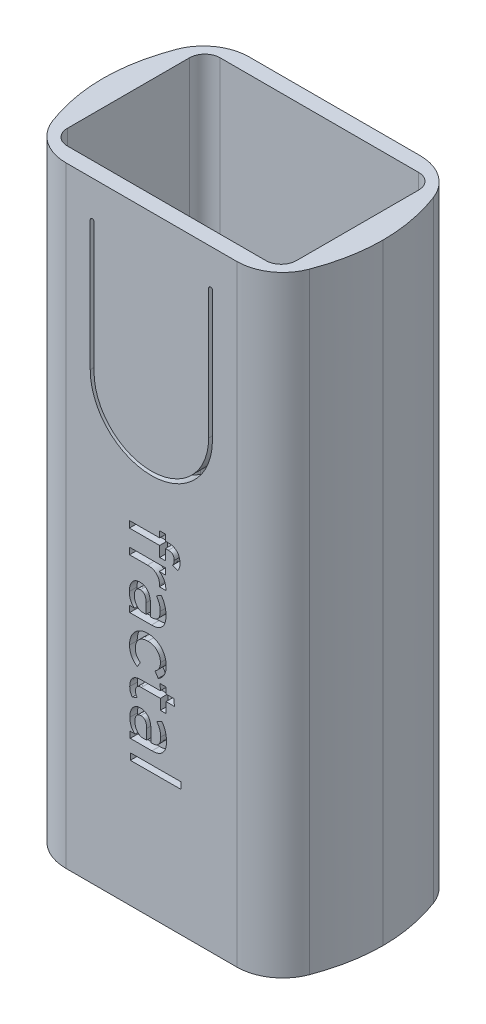
from build123d import *

# Parameters (mm, degrees)
BOSS_EXTRUDE4_DEPTH = 80
BOSS_EXTRUDE5_DEPTH = 57
CUT_EXTRUDE1_DEPTH  = 2
CUT_EXTRUDE2_DEPTH  = 1


with BuildPart() as part:
    # Sketch8 → Boss-Extrude4 (new body)
    with BuildSketch(Plane(origin=(0, 58, 0), x_dir=(1, 0, 0), z_dir=(0, 1, 0))):
        with BuildLine():
            Line((-11.194828593, 12.000000011), (11.194828559, 12.000000011))
            ThreePointArc((11.194828559, 12.000000011), (14.611088941, 10.932460351), (16.811684841, 8.109721678))
            add(Edge.make_bspline(
                [(18.334712564, 1.1e-08), (18.327162677, 2.726130673), (17.819510816, 5.426517656), (16.811684841, 8.109721678)],
                knots=[0.502499344, 0.502499344, 0.502499344, 0.502499344, 0.837905074, 0.837905074, 0.837905074, 0.837905074], degree=3))
            add(Edge.make_bspline(
                [(18.334712564, 1.1e-08), (18.327162677, -2.72613065), (17.819510816, -5.426517634), (16.811684841, -8.109721656)],
                knots=[0.502499344, 0.502499344, 0.502499344, 0.502499344, 0.837905074, 0.837905074, 0.837905074, 0.837905074], degree=3))
            ThreePointArc((16.811684841, -8.109721656), (14.611088941, -10.932460328), (11.194828559, -11.999999989))
            Line((11.194828559, -11.999999989), (-11.194828593, -11.999999989))
            ThreePointArc((-11.194828593, -11.999999989), (-14.611088975, -10.932460328), (-16.811684874, -8.109721656))
            add(Edge.make_bspline(
                [(-18.334712598, 1.1e-08), (-18.327162711, -2.72613065), (-17.81951085, -5.426517634), (-16.811684874, -8.109721656)],
                knots=[0.502499344, 0.502499344, 0.502499344, 0.502499344, 0.837905074, 0.837905074, 0.837905074, 0.837905074], degree=3))
            add(Edge.make_bspline(
                [(-18.334712598, 1.1e-08), (-18.327162711, 2.726130673), (-17.81951085, 5.426517656), (-16.811684874, 8.109721678)],
                knots=[0.502499344, 0.502499344, 0.502499344, 0.502499344, 0.837905074, 0.837905074, 0.837905074, 0.837905074], degree=3))
            ThreePointArc((-16.811684874, 8.109721678), (-14.611088975, 10.932460351), (-11.194828593, 12.000000011))
        make_face()
        with BuildLine():
            Line((-15.000000017, -7.999999989), (-15.000000017, 8.000000011))
            ThreePointArc((-15.000000017, 8.000000011), (-14.414213579, 9.414213574), (-13.000000017, 10.000000011))
            Line((-13.000000017, 10.000000011), (12.999999983, 10.000000011))
            ThreePointArc((12.999999983, 10.000000011), (14.414213546, 9.414213574), (14.999999983, 8.000000011))
            Line((14.999999983, 8.000000011), (14.999999983, -7.999999989))
            ThreePointArc((14.999999983, -7.999999989), (14.414213546, -9.414213551), (12.999999983, -9.999999989))
            Line((12.999999983, -9.999999989), (-13.000000017, -9.999999989))
            ThreePointArc((-13.000000017, -9.999999989), (-14.414213579, -9.414213551), (-15.000000017, -7.999999989))
        make_face(mode=Mode.SUBTRACT)
    extrude(amount=BOSS_EXTRUDE4_DEPTH)

    # Sketch11 → Boss-Extrude5 (add)
    with BuildSketch(Plane(origin=(0, 58, 0), x_dir=(1, 0, 0), z_dir=(0, 1, 0))):
        with BuildLine():
            Line((13, 10.000000011), (15, 10.000000011))
            Line((15, 10.000000011), (15, 6.937911183))
            Line((15, 6.937911183), (13.5, 6.937911183))
            ThreePointArc((13.5, 6.937911183), (13.146446609, 7.084357793), (13, 7.437911183))
            Line((13, 7.437911183), (13, 10.000000011))
        make_face()
        with BuildLine():
            Line((-13, 7.437911183), (-13, 10.000000011))
            Line((-13, 10.000000011), (-15, 10.000000011))
            Line((-15, 10.000000011), (-15, 6.937911183))
            Line((-15, 6.937911183), (-13.5, 6.937911183))
            ThreePointArc((-13.5, 6.937911183), (-13.146446609, 7.084357793), (-13, 7.437911183))
        make_face()
    extrude(amount=BOSS_EXTRUDE5_DEPTH)

    # Sketch12 → Cut-Extrude1 (cut)
    with BuildSketch(Plane.XY.offset(11.999999989)):
        with BuildLine():
            Line((7.5, 133.134156445), (7.5, 116.134156445))
            ThreePointArc((7.5, 116.134156445), (0, 108.634156445), (-7.5, 116.134156445))
            Line((-7.5, 116.134156445), (-7.5, 133.134156445))
            ThreePointArc((-7.5, 133.134156445), (-7.75, 133.384156445), (-8, 133.134156445))
            Line((-8, 133.134156445), (-8, 116.134156445))
            ThreePointArc((-8, 116.134156445), (0, 108.134156445), (8, 116.134156445))
            Line((8, 116.134156445), (8, 133.134156445))
            ThreePointArc((8, 133.134156445), (7.75, 133.384156445), (7.5, 133.134156445))
        make_face()
    extrude(amount=-CUT_EXTRUDE1_DEPTH, mode=Mode.SUBTRACT)

    # Sketch13 → Cut-Extrude2 (cut)
    # profile 1 of 7: a face of its own
    with BuildSketch(Plane.XY.offset(11.999999989)):
        with BuildLine():
            add(Edge.make_bspline(
                [(2.996859787, 100.008970815), (2.994442675, 100.069053526), (2.989871425, 100.182682149), (2.954399054, 100.341902764), (2.892932854, 100.477356256), (2.807324868, 100.589862971), (2.694766888, 100.676080453), (2.558115425, 100.735302508), (2.398722521, 100.769899312), (2.285163968, 100.773613049), (2.225081621, 100.775577939)],
                knots=[0, 0, 0, 0, 1.156076077, 2.186374906, 3.118039986, 3.9991384, 4.880236814, 5.816029218, 6.844489569, 8, 8, 8, 8], degree=3))
            Line((2.225081621, 100.775577939), (1.84500996, 100.774285178))
            Line((1.84500996, 100.774285178), (1.850181003, 99.397494981))
            Line((1.850181003, 99.397494981), (1.096501487, 99.394909459))
            Line((1.096501487, 99.394909459), (1.091330444, 100.753601006))
            Line((1.091330444, 100.753601006), (-2.870981251, 100.739380638))
            Line((-2.870981251, 100.739380638), (-2.873566772, 101.596481014))
            Line((-2.873566772, 101.596481014), (1.088744922, 101.610701382))
            Line((1.088744922, 101.610701382), (1.08486664, 102.414798568))
            Line((1.08486664, 102.414798568), (1.838546157, 102.417384089))
            Line((1.838546157, 102.417384089), (1.842424439, 101.613286904))
            Line((1.842424439, 101.613286904), (2.252229596, 101.614579665))
            add(Edge.make_bspline(
                [(2.252229596, 101.614579665), (2.308321941, 101.613997272), (2.417854173, 101.612860025), (2.577254158, 101.592047583), (2.728348763, 101.562385752), (2.869594544, 101.51628952), (3.002692565, 101.459230051), (3.127645118, 101.389949212), (3.241414284, 101.304630342), (3.346819459, 101.209033008), (3.441022623, 101.101306177), (3.524831441, 100.983775836), (3.592552706, 100.853727478), (3.652318219, 100.715312825), (3.694679474, 100.564613346), (3.727664107, 100.40444935), (3.746966232, 100.233949827), (3.749330197, 100.116748415), (3.750539304, 100.056802963)],
                knots=[0, 0, 0, 0, 1.097709537, 2.143511294, 3.143277349, 4.109492138, 5.047045896, 5.976664486, 6.900016993, 7.825988726, 8.758896387, 9.697854663, 10.64560979, 11.625295719, 12.645514775, 13.704851478, 14.826091653, 16, 16, 16, 16], degree=3))
            add(Edge.make_bspline(
                [(3.750539304, 100.056802963), (3.750047569, 100.009789115), (3.749079732, 99.917256092), (3.733842969, 99.780815792), (3.711288681, 99.648371801), (3.677403212, 99.521551313), (3.636506398, 99.400575985), (3.586122565, 99.287923461), (3.526915558, 99.183812255), (3.480132645, 99.120842998), (3.457082614, 99.089817923)],
                knots=[0, 0, 0, 0, 1.095684027, 2.156533885, 3.197301538, 4.225821855, 5.214090456, 6.172114358, 7.099397213, 8, 8, 8, 8], degree=3))
            Line((3.457082614, 99.089817923), (2.77709046, 99.347077312))
            add(Edge.make_bspline(
                [(2.77709046, 99.347077312), (2.811307768, 99.396864956), (2.878752246, 99.494999551), (2.946247382, 99.659569817), (2.990477945, 99.831238294), (2.994714364, 99.949221384), (2.996859787, 100.008970815)],
                knots=[0, 0, 0, 0, 1.019073746, 2.008658809, 2.991537665, 4, 4, 4, 4], degree=3))
        make_face()
    # profile 2 of 7: a face of its own
    with BuildSketch(Plane.XY.offset(11.999999989)):
        with BuildLine():
            add(Edge.make_bspline(
                [(1.036053582, 97.769942784), (1.103875415, 97.730706339), (1.238462592, 97.652844652), (1.414331417, 97.498394304), (1.564896856, 97.31789749), (1.687801844, 97.110071254), (1.784447341, 96.877975256), (1.856267448, 96.622571505), (1.896540948, 96.342707541), (1.902827244, 96.148515681), (1.906081566, 96.047985467)],
                knots=[0, 0, 0, 0, 0.923300537, 1.832218434, 2.746177591, 3.688542436, 4.671287428, 5.70702361, 6.812960502, 8, 8, 8, 8], degree=3))
            Line((1.906081566, 96.047985467), (1.051566711, 96.045399945))
            add(Edge.make_bspline(
                [(1.051566711, 96.045399945), (1.059606728, 96.073669983), (1.077845414, 96.13780024), (1.078402934, 96.204565772), (1.078714687, 96.241899579)],
                knots=[0, 0, 0, 0, 0.881644283, 2, 2, 2, 2], degree=3))
            add(Edge.make_bspline(
                [(1.078714687, 96.241899579), (1.077689807, 96.298426551), (1.075687482, 96.408864301), (1.053770407, 96.569606212), (1.022117097, 96.721636455), (0.977375298, 96.864667662), (0.917281524, 96.996866022), (0.845372395, 97.119893567), (0.761587599, 97.234133223), (0.663784031, 97.337570309), (0.55537511, 97.431476358), (0.433957469, 97.511338651), (0.303008671, 97.580413374), (0.160791259, 97.636155381), (0.007419093, 97.678798281), (-0.157152279, 97.707547532), (-0.332104665, 97.726484554), (-0.452292275, 97.727865703), (-0.513966555, 97.72857444)],
                knots=[0, 0, 0, 0, 1.095269644, 2.139847753, 3.139419918, 4.103842245, 5.038679069, 5.9485804, 6.862614884, 7.778785143, 8.703109413, 9.636937683, 10.589892468, 11.568861415, 12.592548889, 13.670862473, 14.804802925, 16, 16, 16, 16], degree=3))
            Line((-0.513966555, 97.72857444), (-2.856449032, 97.720817875))
            Line((-2.856449032, 97.720817875), (-2.860327314, 98.577918252))
            Line((-2.860327314, 98.577918252), (1.855663897, 98.594724142))
            Line((1.855663897, 98.594724142), (1.858249418, 97.772528305))
            Line((1.858249418, 97.772528305), (1.036053582, 97.769942784))
        make_face()
    # profile 3 of 7: a face of its own
    with BuildSketch(Plane.XY.offset(11.999999989)):
        with BuildLine():
            add(Edge.make_bspline(
                [(1.920322824, 93.229805924), (1.919366439, 93.150459059), (1.917501675, 92.995748208), (1.894856775, 92.771124833), (1.859541508, 92.560375242), (1.807695396, 92.363868192), (1.740796797, 92.181529158), (1.659143208, 92.013042295), (1.561681632, 91.859387756), (1.448853254, 91.720564081), (1.32118622, 91.596439595), (1.178281321, 91.488817692), (1.020649525, 91.397785483), (0.848158857, 91.32406852), (0.661113429, 91.265706478), (0.458793661, 91.225047002), (0.242062284, 91.200431317), (0.09285678, 91.196845508), (0.016086241, 91.195000505)],
                knots=[0, 0, 0, 0, 1.194633167, 2.329300778, 3.396298306, 4.410116943, 5.385480457, 6.317221988, 7.224663686, 8.119696338, 9.005528062, 9.89987805, 10.807134053, 11.740298557, 12.719455093, 13.753004121, 14.843855749, 16, 16, 16, 16], degree=3))
            Line((0.016086241, 91.195000505), (-2.829280166, 91.184658419))
            Line((-2.829280166, 91.184658419), (-2.833158449, 91.99780493))
            Line((-2.833158449, 91.99780493), (-2.194534639, 92.000390452))
            add(Edge.make_bspline(
                [(-2.194534639, 92.000390452), (-2.247616777, 92.037961494), (-2.354542073, 92.113642221), (-2.490823928, 92.258154022), (-2.6092197, 92.423807132), (-2.706700413, 92.612009284), (-2.784703993, 92.820668672), (-2.837025139, 93.049003021), (-2.873956185, 93.294549747), (-2.877741544, 93.464938443), (-2.879697836, 93.552996111)],
                knots=[0, 0, 0, 0, 0.880187349, 1.772993617, 2.677959877, 3.634756253, 4.6389316, 5.690754913, 6.806571438, 8, 8, 8, 8], degree=3))
            add(Edge.make_bspline(
                [(-2.879697836, 93.552996111), (-2.879022549, 93.617688986), (-2.87770512, 93.743899509), (-2.858208051, 93.928161995), (-2.831060296, 94.103031535), (-2.789846088, 94.268040312), (-2.734578731, 94.422263836), (-2.670864451, 94.568156009), (-2.592613755, 94.702942006), (-2.503491585, 94.827286226), (-2.404686448, 94.939004579), (-2.2977613, 95.037709903), (-2.182215248, 95.120140517), (-2.060079307, 95.189782199), (-1.929698486, 95.243156992), (-1.791911854, 95.279945439), (-1.646846068, 95.304552671), (-1.54739765, 95.307205826), (-1.496443835, 95.308565207)],
                knots=[0, 0, 0, 0, 1.236884418, 2.413060612, 3.540540454, 4.620117252, 5.660332507, 6.671365111, 7.661070386, 8.635589767, 9.593264899, 10.509273167, 11.412884209, 12.302399144, 13.193287967, 14.099152032, 15.026073445, 16, 16, 16, 16], degree=3))
            add(Edge.make_bspline(
                [(-1.496443835, 95.308565207), (-1.445532306, 95.307437441), (-1.345851134, 95.305229355), (-1.199976629, 95.284566442), (-1.06248363, 95.247722858), (-0.932042113, 95.198851825), (-0.809708929, 95.134938196), (-0.694672385, 95.056487193), (-0.587853246, 94.96333538), (-0.488545291, 94.856280929), (-0.398173736, 94.733955208), (-0.321434834, 94.5934665), (-0.25534786, 94.437116795), (-0.200738794, 94.264088316), (-0.161066596, 94.073763353), (-0.129255225, 93.86717281), (-0.111886925, 93.643785235), (-0.109335446, 93.489246963), (-0.108018791, 93.409499668)],
                knots=[0, 0, 0, 0, 0.916463544, 1.794370807, 2.645108922, 3.475213065, 4.297775453, 5.124244829, 5.976856468, 6.844414757, 7.749241036, 8.707930238, 9.719698123, 10.801971438, 11.969358077, 13.217122862, 14.563935505, 16, 16, 16, 16], degree=3))
            Line((-0.108018791, 93.409499668), (-0.102847748, 92.052100882))
            Line((-0.102847748, 92.052100882), (0.061332868, 92.053393642))
            add(Edge.make_bspline(
                [(0.061332868, 92.053393642), (0.104898567, 92.054350398), (0.189735172, 92.056213513), (0.312758117, 92.071655636), (0.427619048, 92.098139993), (0.535195336, 92.132027361), (0.634628708, 92.178322534), (0.726820454, 92.233329617), (0.809878916, 92.300281308), (0.885597231, 92.375840717), (0.953544485, 92.461114878), (1.009325852, 92.557894934), (1.059968557, 92.662305503), (1.098842573, 92.777160081), (1.130339059, 92.901163795), (1.151700016, 93.034413902), (1.164882662, 93.176963701), (1.166045209, 93.275021935), (1.166643308, 93.325470219)],
                knots=[0, 0, 0, 0, 1.087095932, 2.116929776, 3.087495738, 4.026195392, 4.926078734, 5.818799804, 6.698928788, 7.581092451, 8.484759662, 9.410680545, 10.363202438, 11.376790667, 12.430605746, 13.553346728, 14.741263706, 16, 16, 16, 16], degree=3))
            add(Edge.make_bspline(
                [(1.166643308, 93.325470219), (1.164961923, 93.39537432), (1.161617513, 93.534419309), (1.132810638, 93.74144507), (1.089156791, 93.945948508), (1.028798622, 94.146070157), (0.953964715, 94.337117676), (0.869812223, 94.516418755), (0.771385845, 94.679082754), (0.695705137, 94.777033687), (0.658588333, 94.825072687)],
                knots=[0, 0, 0, 0, 1.040240382, 2.069123414, 3.105935914, 4.151149396, 5.176887612, 6.15823228, 7.096724489, 8, 8, 8, 8], degree=3))
            Line((0.658588333, 94.825072687), (1.294626622, 95.184460175))
            add(Edge.make_bspline(
                [(1.294626622, 95.184460175), (1.343463557, 95.121683814), (1.44217203, 94.994801184), (1.565541296, 94.783181412), (1.671764571, 94.554450527), (1.760050802, 94.309401228), (1.831026102, 94.052314931), (1.881219363, 93.785068581), (1.912921225, 93.510228823), (1.917841073, 93.323831522), (1.920322824, 93.229805924)],
                knots=[0, 0, 0, 0, 0.911948218, 1.84321592, 2.803447203, 3.803124136, 4.828931034, 5.860930113, 6.920975116, 8, 8, 8, 8], degree=3))
        make_face()
        with BuildLine():
            add(Edge.make_bspline(
                [(-2.217804332, 93.412085189), (-2.214537109, 93.333058331), (-2.208170566, 93.179065832), (-2.167083783, 92.956340098), (-2.096272486, 92.750594431), (-1.999796995, 92.56285984), (-1.877355526, 92.395038398), (-1.7300613, 92.252551296), (-1.560595648, 92.132296171), (-1.433409886, 92.076642832), (-1.36846052, 92.048222599)],
                knots=[0, 0, 0, 0, 1.107624716, 2.158328203, 3.161069341, 4.1470274, 5.106168223, 6.058611225, 7.008599968, 8, 8, 8, 8], degree=3))
            Line((-1.36846052, 92.048222599), (-0.682004563, 92.050808121))
            Line((-0.682004563, 92.050808121), (-0.685882845, 93.373302367))
            add(Edge.make_bspline(
                [(-0.685882845, 93.373302367), (-0.686779846, 93.417271757), (-0.688522957, 93.502716035), (-0.697534304, 93.626118841), (-0.711581331, 93.741425238), (-0.731488125, 93.847919839), (-0.759295231, 93.945749048), (-0.791083056, 94.035662545), (-0.829854193, 94.116978624), (-0.873737684, 94.18997868), (-0.923468111, 94.254353714), (-0.979097409, 94.310476622), (-1.041564835, 94.357213108), (-1.109682185, 94.39471952), (-1.182706516, 94.425290786), (-1.262477748, 94.445219502), (-1.347740529, 94.458805736), (-1.406755351, 94.459935569), (-1.43697684, 94.460514156)],
                knots=[0, 0, 0, 0, 1.406466117, 2.733139608, 3.955475891, 5.120520237, 6.19399674, 7.205516833, 8.16726469, 9.070230271, 9.924882662, 10.763038536, 11.590013935, 12.410647846, 13.245055596, 14.114254431, 15.03430973, 16, 16, 16, 16], degree=3))
            add(Edge.make_bspline(
                [(-1.43697684, 94.460514156), (-1.466758033, 94.459390642), (-1.524450664, 94.45721415), (-1.609049596, 94.443991346), (-1.68836703, 94.422234587), (-1.763910069, 94.392334027), (-1.833223683, 94.352244736), (-1.897714909, 94.302959217), (-1.958238542, 94.246865116), (-2.032073521, 94.158343832), (-2.108487035, 94.027319074), (-2.172820486, 93.845430846), (-2.211454608, 93.637347272), (-2.215612909, 93.489827848), (-2.217804332, 93.412085189)],
                knots=[0, 0, 0, 0, 0.728138518, 1.410562256, 2.08784356, 2.735384695, 3.39135516, 4.03821034, 4.716474161, 5.404405324, 6.849819608, 8.396140257, 10.100767796, 12, 12, 12, 12], degree=3))
        make_face(mode=Mode.SUBTRACT)
    # profile 4 of 7: a face of its own
    with BuildSketch(Plane.XY.offset(11.999999989)):
        with BuildLine():
            add(Edge.make_bspline(
                [(-2.852254572, 87.496469453), (-2.851758989, 87.555971128), (-2.850780684, 87.673430443), (-2.835485534, 87.84728828), (-2.813279509, 88.016292103), (-2.778772463, 88.180123405), (-2.736564173, 88.339689535), (-2.683573894, 88.49421967), (-2.621126147, 88.644143644), (-2.549075541, 88.788474247), (-2.467480483, 88.926140119), (-2.379745748, 89.057516435), (-2.283349885, 89.180648965), (-2.180562064, 89.296766459), (-2.069992642, 89.404834082), (-1.951586547, 89.504420435), (-1.826906513, 89.597632164), (-1.694230074, 89.681480336), (-1.556564503, 89.758034582), (-1.412950508, 89.823830915), (-1.264622574, 89.879377895), (-1.112536993, 89.926590008), (-0.954920195, 89.960807421), (-0.793585255, 89.986911719), (-0.627301241, 90.002832342), (-0.514977574, 90.004747586), (-0.458061665, 90.005718066)],
                knots=[0, 0, 0, 0, 1.102559599, 2.176508381, 3.232725517, 4.260376471, 5.277606188, 6.290530317, 7.28591771, 8.286132841, 9.277956381, 10.250519377, 11.212395994, 12.174239445, 13.123194071, 14.075370507, 15.04029356, 16.006406081, 16.982407154, 17.958146703, 18.931365508, 19.916799904, 20.907078346, 21.918237249, 22.945142898, 24, 24, 24, 24], degree=3))
            add(Edge.make_bspline(
                [(-0.458061665, 90.005718066), (-0.401139874, 90.005307711), (-0.288364227, 90.004494699), (-0.121784571, 89.987875208), (0.040464776, 89.963352471), (0.198522318, 89.930549532), (0.351330629, 89.884892178), (0.499122517, 89.828738608), (0.643225436, 89.764210259), (0.782395752, 89.689546746), (0.914830813, 89.605336097), (1.041505564, 89.515079497), (1.158989018, 89.414629301), (1.270048168, 89.30806152), (1.373292976, 89.193079829), (1.468039953, 89.070073983), (1.558731612, 88.941063778), (1.637298501, 88.802413072), (1.710988367, 88.659195535), (1.77209148, 88.509066028), (1.825246536, 88.35502173), (1.869991365, 88.196393214), (1.902827187, 88.032461649), (1.927407269, 87.863749555), (1.943660668, 87.690268113), (1.945527734, 87.572778891), (1.946473327, 87.513275342)],
                knots=[0, 0, 0, 0, 1.055574105, 2.091344122, 3.102161191, 4.09941903, 5.083418003, 6.057493825, 7.030781931, 8.010843265, 8.984558129, 9.940887082, 10.893902006, 11.849428613, 12.79486845, 13.757592096, 14.728908118, 15.71757277, 16.711524436, 17.715170923, 18.721425033, 19.73394791, 20.770334824, 21.820688691, 22.896266789, 24, 24, 24, 24], degree=3))
            add(Edge.make_bspline(
                [(1.946473327, 87.513275342), (1.945732196, 87.460252008), (1.944272203, 87.355798466), (1.932581974, 87.201228566), (1.912097884, 87.050927177), (1.881857603, 86.904776461), (1.84514165, 86.762366502), (1.797734559, 86.625020481), (1.74412901, 86.49150538), (1.680253737, 86.36359753), (1.609446897, 86.240694524), (1.530711583, 86.124212384), (1.443876284, 86.015244367), (1.348906162, 85.913966587), (1.246499296, 85.81991858), (1.13780285, 85.730888532), (1.019867867, 85.651203801), (0.937119215, 85.603381652), (0.895458839, 85.579305262)],
                knots=[0, 0, 0, 0, 1.098315491, 2.163631245, 3.208936806, 4.238341213, 5.253833846, 6.253150331, 7.246107156, 8.23217857, 9.212089004, 10.182643593, 11.141800873, 12.095459117, 13.055654333, 14.020403207, 15.003358424, 16, 16, 16, 16], degree=3))
            Line((0.895458839, 85.579305262), (0.486946442, 86.229563919))
            add(Edge.make_bspline(
                [(0.486946442, 86.229563919), (0.543710376, 86.267692451), (0.654723641, 86.342260448), (0.798272701, 86.477620184), (0.922092608, 86.623314349), (1.022180772, 86.783172177), (1.097970037, 86.955250293), (1.154291233, 87.13544852), (1.187322006, 87.325041178), (1.190949393, 87.454111008), (1.192793811, 87.519739146)],
                knots=[0, 0, 0, 0, 1.064608294, 2.082055211, 3.064512282, 4.039542989, 5.011025124, 5.988645313, 6.977286462, 8, 8, 8, 8], degree=3))
            add(Edge.make_bspline(
                [(1.192793811, 87.519739146), (1.190401303, 87.595317604), (1.185706323, 87.743630318), (1.146086945, 87.959721397), (1.080617852, 88.163617562), (0.991668222, 88.355058796), (0.879565561, 88.531500753), (0.743711765, 88.688404271), (0.585606295, 88.823646666), (0.407786873, 88.937747061), (0.212435712, 89.028122873), (0.002046801, 89.092820496), (-0.222102031, 89.132956448), (-0.37644473, 89.136474288), (-0.455476144, 89.138275603)],
                knots=[0, 0, 0, 0, 1.048280959, 2.057112559, 3.036806998, 4.013375124, 4.978893661, 5.928557386, 6.882748488, 7.856529243, 8.851887619, 9.860098612, 10.904260237, 12, 12, 12, 12], degree=3))
            add(Edge.make_bspline(
                [(-0.455476144, 89.138275603), (-0.535333481, 89.135302222), (-0.691273697, 89.129495996), (-0.918222207, 89.09124749), (-1.129004477, 89.022959681), (-1.324052175, 88.931339481), (-1.500531967, 88.815797444), (-1.657391656, 88.679296117), (-1.791484459, 88.52121479), (-1.902672658, 88.344680444), (-1.990579625, 88.152854236), (-2.054232962, 87.948363246), (-2.092799675, 87.73192087), (-2.096625011, 87.583675452), (-2.098575055, 87.508104299)],
                knots=[0, 0, 0, 0, 1.105946299, 2.15962003, 3.174945402, 4.165288797, 5.135212795, 6.086751454, 7.035009744, 7.99524745, 8.967207045, 9.948682835, 10.954298865, 12, 12, 12, 12], degree=3))
            add(Edge.make_bspline(
                [(-2.098575055, 87.508104299), (-2.096094622, 87.442490845), (-2.091219987, 87.313544943), (-2.059944722, 87.124104128), (-2.006548937, 86.944274754), (-1.934216612, 86.7736982), (-1.840882546, 86.614215451), (-1.724145028, 86.469994694), (-1.590902548, 86.33493121), (-1.487026018, 86.260848664), (-1.43409603, 86.223100115)],
                knots=[0, 0, 0, 0, 1.043897527, 2.051504692, 3.045043066, 4.021763435, 4.992958272, 5.973712509, 6.967511037, 8, 8, 8, 8], degree=3))
            Line((-1.43409603, 86.223100115), (-1.83097358, 85.570255937))
            add(Edge.make_bspline(
                [(-1.83097358, 85.570255937), (-1.870932973, 85.593883349), (-1.950314204, 85.640820322), (-2.063139212, 85.719718438), (-2.168246167, 85.806995429), (-2.266456598, 85.901083552), (-2.357027673, 86.002670215), (-2.441837443, 86.109923046), (-2.517958042, 86.225845682), (-2.611198215, 86.389470821), (-2.70717869, 86.609103115), (-2.790083067, 86.889562938), (-2.841584267, 87.187352634), (-2.848647672, 87.391978211), (-2.852254572, 87.496469453)],
                knots=[0, 0, 0, 0, 0.729984724, 1.450149289, 2.162618196, 2.876858015, 3.587196001, 4.301725188, 5.025453056, 5.766089582, 7.262189851, 8.78259527, 10.357044991, 12, 12, 12, 12], degree=3))
        make_face()
    # profile 5 of 7: a face of its own
    with BuildSketch(Plane.XY.offset(11.999999989)):
        with BuildLine():
            add(Edge.make_bspline(
                [(-2.488548033, 81.769594134), (-2.515240623, 81.801733628), (-2.569780857, 81.867403369), (-2.636836669, 81.979003475), (-2.69611242, 82.100866872), (-2.743927204, 82.232813958), (-2.782818456, 82.371493901), (-2.809250964, 82.513892752), (-2.827294005, 82.658119484), (-2.828985957, 82.755053082), (-2.82983687, 82.803802733)],
                knots=[0, 0, 0, 0, 0.900892627, 1.840769012, 2.802000153, 3.823437685, 4.866302937, 5.908213203, 6.948002762, 8, 8, 8, 8], degree=3))
            add(Edge.make_bspline(
                [(-2.82983687, 82.803802733), (-2.828938968, 82.861578418), (-2.827186002, 82.974373276), (-2.810806432, 83.138861116), (-2.780385954, 83.292914482), (-2.74151916, 83.43772261), (-2.687230981, 83.571230884), (-2.62473718, 83.69663747), (-2.547647443, 83.810756856), (-2.459313662, 83.914949001), (-2.359934428, 84.007706752), (-2.250299215, 84.089360611), (-2.129223573, 84.155901524), (-1.998979288, 84.211948248), (-1.858733571, 84.256182711), (-1.708291006, 84.286206965), (-1.547972767, 84.306617944), (-1.437601666, 84.308762468), (-1.380652071, 84.309869005)],
                knots=[0, 0, 0, 0, 1.165310872, 2.275024066, 3.328572464, 4.330359325, 5.294009788, 6.230904069, 7.151855587, 8.064524368, 8.980869866, 9.888391198, 10.814578691, 11.760781957, 12.744991577, 13.774674195, 14.851770066, 16, 16, 16, 16], degree=3))
            Line((-1.380652071, 84.309869005), (1.168672125, 84.31891833))
            Line((1.168672125, 84.31891833), (1.164793843, 85.123015516))
            Line((1.164793843, 85.123015516), (1.918473359, 85.125601037))
            Line((1.918473359, 85.125601037), (1.922351642, 84.321503852))
            Line((1.922351642, 84.321503852), (2.997928584, 84.325382134))
            Line((2.997928584, 84.325382134), (3.000514106, 83.468281758))
            Line((3.000514106, 83.468281758), (1.924937163, 83.464403475))
            Line((1.924937163, 83.464403475), (1.930108206, 82.105711929))
            Line((1.930108206, 82.105711929), (1.17642869, 82.103126407))
            Line((1.17642869, 82.103126407), (1.171257647, 83.461817954))
            Line((1.171257647, 83.461817954), (-1.30955023, 83.452768629))
            add(Edge.make_bspline(
                [(-1.30955023, 83.452768629), (-1.367920658, 83.450329679), (-1.479004222, 83.445688165), (-1.635452977, 83.409844045), (-1.770544604, 83.348674405), (-1.882943812, 83.26306196), (-1.972392766, 83.154693646), (-2.032179051, 83.022984133), (-2.071405908, 82.872416917), (-2.074516567, 82.764867699), (-2.076157354, 82.708138438)],
                knots=[0, 0, 0, 0, 1.150427981, 2.189355869, 3.143791496, 4.053160586, 4.953069089, 5.884410574, 6.884084616, 8, 8, 8, 8], degree=3))
            add(Edge.make_bspline(
                [(-2.076157354, 82.708138438), (-2.073419892, 82.644979708), (-2.068092676, 82.522070196), (-2.026761398, 82.34524426), (-1.960643141, 82.181517109), (-1.893660977, 82.086935697), (-1.860266309, 82.03978113)],
                knots=[0, 0, 0, 0, 1.058899387, 2.060662217, 3.033122574, 4, 4, 4, 4], degree=3))
            Line((-1.860266309, 82.03978113), (-2.488548033, 81.769594134))
        make_face()
    # profile 6 of 7: a face of its own
    with BuildSketch(Plane.XY.offset(11.999999989)):
        with BuildLine():
            add(Edge.make_bspline(
                [(1.986100235, 78.999247622), (1.98514385, 78.919900757), (1.983279086, 78.765189906), (1.960634186, 78.540566531), (1.925318919, 78.329816941), (1.873472807, 78.133309891), (1.806574208, 77.950970857), (1.724920619, 77.782483994), (1.627459043, 77.628829455), (1.514630664, 77.49000578), (1.386963631, 77.365881294), (1.244058731, 77.258259391), (1.086426936, 77.167227182), (0.913936268, 77.093510218), (0.726890839, 77.035148176), (0.524571072, 76.9944887), (0.307839695, 76.969873016), (0.158634191, 76.966287206), (0.081863652, 76.964442204)],
                knots=[0, 0, 0, 0, 1.194633167, 2.329300778, 3.396298306, 4.410116943, 5.385480457, 6.317221988, 7.224663686, 8.119696338, 9.005528062, 9.89987805, 10.807134053, 11.740298557, 12.719455093, 13.753004121, 14.843855749, 16, 16, 16, 16], degree=3))
            Line((0.081863652, 76.964442204), (-2.763502756, 76.954100118))
            Line((-2.763502756, 76.954100118), (-2.767381038, 77.767246629))
            Line((-2.767381038, 77.767246629), (-2.128757228, 77.76983215))
            add(Edge.make_bspline(
                [(-2.128757228, 77.76983215), (-2.181839366, 77.807403193), (-2.288764662, 77.88308392), (-2.425046517, 78.027595721), (-2.543442289, 78.193248831), (-2.640923002, 78.381450983), (-2.718926582, 78.59011037), (-2.771247728, 78.81844472), (-2.808178775, 79.063991445), (-2.811964134, 79.234380142), (-2.813920425, 79.322437809)],
                knots=[0, 0, 0, 0, 0.880187349, 1.772993617, 2.677959877, 3.634756253, 4.6389316, 5.690754913, 6.806571438, 8, 8, 8, 8], degree=3))
            add(Edge.make_bspline(
                [(-2.813920425, 79.322437809), (-2.813245138, 79.387130685), (-2.811927709, 79.513341207), (-2.79243064, 79.697603694), (-2.765282885, 79.872473234), (-2.724068677, 80.037482011), (-2.66880132, 80.191705535), (-2.605087041, 80.337597708), (-2.526836345, 80.472383705), (-2.437714174, 80.596727925), (-2.338909037, 80.708446278), (-2.231983889, 80.807151602), (-2.116437837, 80.889582216), (-1.994301897, 80.959223898), (-1.863921075, 81.012598691), (-1.726134443, 81.049387137), (-1.581068657, 81.07399437), (-1.481620239, 81.076647524), (-1.430666424, 81.078006906)],
                knots=[0, 0, 0, 0, 1.236884418, 2.413060612, 3.540540454, 4.620117252, 5.660332507, 6.671365111, 7.661070386, 8.635589767, 9.593264899, 10.509273167, 11.412884209, 12.302399144, 13.193287967, 14.099152032, 15.026073445, 16, 16, 16, 16], degree=3))
            add(Edge.make_bspline(
                [(-1.430666424, 81.078006906), (-1.379754895, 81.07687914), (-1.280073723, 81.074671054), (-1.134199218, 81.054008141), (-0.996706219, 81.017164557), (-0.866264702, 80.968293524), (-0.743931518, 80.904379895), (-0.628894974, 80.825928892), (-0.522075836, 80.732777078), (-0.42276788, 80.625722628), (-0.332396325, 80.503396907), (-0.255657423, 80.362908199), (-0.189570449, 80.206558493), (-0.134961383, 80.033530015), (-0.095289185, 79.843205051), (-0.063477814, 79.636614509), (-0.046109515, 79.413226933), (-0.043558035, 79.258688662), (-0.04224138, 79.178941366)],
                knots=[0, 0, 0, 0, 0.916463544, 1.794370807, 2.645108922, 3.475213065, 4.297775453, 5.124244829, 5.976856468, 6.844414757, 7.749241036, 8.707930238, 9.719698123, 10.801971438, 11.969358077, 13.217122862, 14.563935505, 16, 16, 16, 16], degree=3))
            Line((-0.04224138, 79.178941366), (-0.037070337, 77.82154258))
            Line((-0.037070337, 77.82154258), (0.127110278, 77.822835341))
            add(Edge.make_bspline(
                [(0.127110278, 77.822835341), (0.170675978, 77.823792097), (0.255512582, 77.825655212), (0.378535528, 77.841097335), (0.493396458, 77.867581692), (0.600972747, 77.90146906), (0.700406118, 77.947764233), (0.792597865, 78.002771315), (0.875656327, 78.069723007), (0.951374642, 78.145282416), (1.019321896, 78.230556577), (1.075103263, 78.327336632), (1.125745968, 78.431747201), (1.164619984, 78.546601779), (1.19611647, 78.670605494), (1.217477426, 78.803855601), (1.230660073, 78.9464054), (1.23182262, 79.044463634), (1.232420718, 79.094911918)],
                knots=[0, 0, 0, 0, 1.087095932, 2.116929776, 3.087495738, 4.026195392, 4.926078734, 5.818799804, 6.698928788, 7.581092451, 8.484759662, 9.410680545, 10.363202438, 11.376790667, 12.430605746, 13.553346728, 14.741263706, 16, 16, 16, 16], degree=3))
            add(Edge.make_bspline(
                [(1.232420718, 79.094911918), (1.230739334, 79.164816019), (1.227394923, 79.303861007), (1.198588049, 79.510886769), (1.154934202, 79.715390207), (1.094576033, 79.915511856), (1.019742126, 80.106559375), (0.935589634, 80.285860453), (0.837163255, 80.448524453), (0.761482547, 80.546475386), (0.724365744, 80.594514386)],
                knots=[0, 0, 0, 0, 1.040240382, 2.069123414, 3.105935914, 4.151149396, 5.176887612, 6.15823228, 7.096724489, 8, 8, 8, 8], degree=3))
            Line((0.724365744, 80.594514386), (1.360404033, 80.953901874))
            add(Edge.make_bspline(
                [(1.360404033, 80.953901874), (1.409240968, 80.891125513), (1.507949441, 80.764242882), (1.631318707, 80.552623111), (1.737541982, 80.323892226), (1.825828212, 80.078842927), (1.896803513, 79.82175663), (1.946996774, 79.55451028), (1.978698636, 79.279670522), (1.983618484, 79.093273221), (1.986100235, 78.999247622)],
                knots=[0, 0, 0, 0, 0.911948218, 1.84321592, 2.803447203, 3.803124136, 4.828931034, 5.860930113, 6.920975116, 8, 8, 8, 8], degree=3))
        make_face()
        with BuildLine():
            add(Edge.make_bspline(
                [(-2.152026921, 79.181526888), (-2.148759698, 79.102500029), (-2.142393155, 78.948507531), (-2.101306372, 78.725781797), (-2.030495075, 78.52003613), (-1.934019584, 78.332301539), (-1.811578116, 78.164480097), (-1.66428389, 78.021992994), (-1.494818237, 77.90173787), (-1.367632475, 77.846084531), (-1.30268311, 77.817664298)],
                knots=[0, 0, 0, 0, 1.107624716, 2.158328203, 3.161069341, 4.1470274, 5.106168223, 6.058611225, 7.008599968, 8, 8, 8, 8], degree=3))
            Line((-1.30268311, 77.817664298), (-0.616227152, 77.82024982))
            Line((-0.616227152, 77.82024982), (-0.620105434, 79.142744065))
            add(Edge.make_bspline(
                [(-0.620105434, 79.142744065), (-0.621002435, 79.186713456), (-0.622745547, 79.272157734), (-0.631756893, 79.39556054), (-0.64580392, 79.510866937), (-0.665710714, 79.617361537), (-0.69351782, 79.715190747), (-0.725305646, 79.805104244), (-0.764076782, 79.886420323), (-0.807960273, 79.959420379), (-0.8576907, 80.023795413), (-0.913319999, 80.079918321), (-0.975787424, 80.126654806), (-1.043904774, 80.164161219), (-1.116929106, 80.194732485), (-1.196700337, 80.214661201), (-1.281963119, 80.228247435), (-1.34097794, 80.229377268), (-1.371199429, 80.229955855)],
                knots=[0, 0, 0, 0, 1.406466117, 2.733139608, 3.955475891, 5.120520237, 6.19399674, 7.205516833, 8.16726469, 9.070230271, 9.924882662, 10.763038536, 11.590013935, 12.410647846, 13.245055596, 14.114254431, 15.03430973, 16, 16, 16, 16], degree=3))
            add(Edge.make_bspline(
                [(-1.371199429, 80.229955855), (-1.400980622, 80.22883234), (-1.458673253, 80.226655849), (-1.543272186, 80.213433045), (-1.622589619, 80.191676285), (-1.698132658, 80.161775726), (-1.767446272, 80.121686434), (-1.831937499, 80.072400915), (-1.892461131, 80.016306814), (-1.96629611, 79.927785531), (-2.042709624, 79.796760773), (-2.107043076, 79.614872544), (-2.145677197, 79.406788971), (-2.149835499, 79.259269547), (-2.152026921, 79.181526888)],
                knots=[0, 0, 0, 0, 0.728138518, 1.410562256, 2.08784356, 2.735384695, 3.39135516, 4.03821034, 4.716474161, 5.404405324, 6.849819608, 8.396140257, 10.100767796, 12, 12, 12, 12], degree=3))
        make_face(mode=Mode.SUBTRACT)
    # profile 7 of 7: a face of its own
    with BuildSketch(Plane.XY.offset(11.999999989)):
        Polygon((3.866069652, 75.352427), (3.869947934, 74.495326623), (-2.748987099, 74.47205693), (-2.752865381, 75.329157306), align=None)
    extrude(amount=-CUT_EXTRUDE2_DEPTH, mode=Mode.SUBTRACT)


solid = part.part
